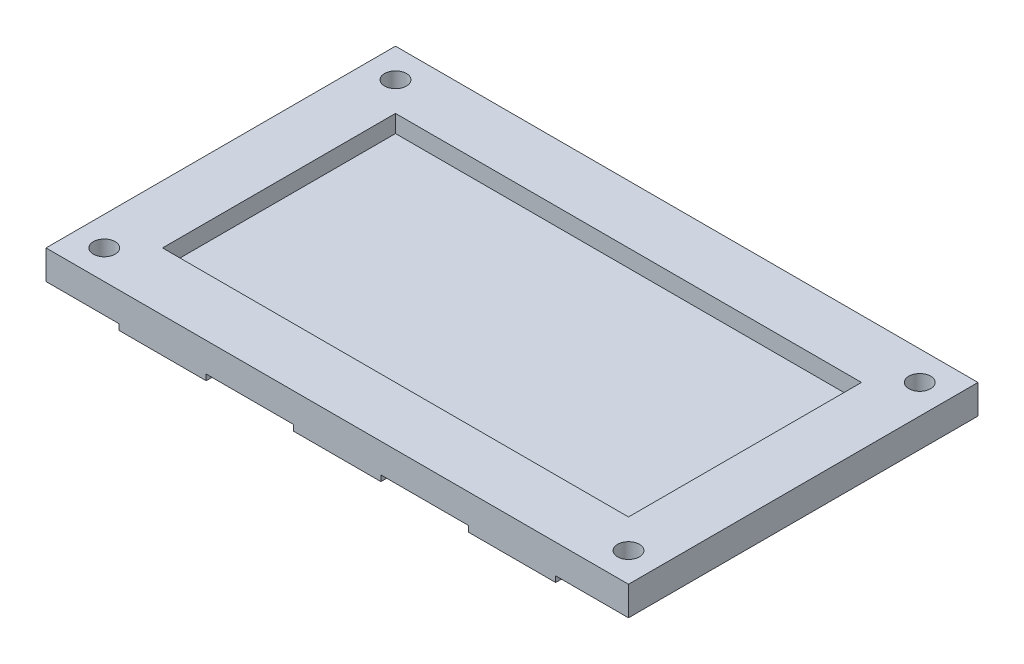
from build123d import *

# Parameters (mm, degrees)
SKETCH1_W             = 200
SKETCH1_H             = 120
BOSS_EXTRUDE3_DEPTH   = 10
SKETCH3_R             = 3.75
SKETCH3_W             = 160
SKETCH3_H             = 80
CUT_EXTRUDE2_DEPTH    = 6
SKETCH6_R             = 3.75
CUT_EXTRUDE4_DEPTH    = 117.773284616
SKETCH7_W             = 30
SKETCH7_H             = 120
BOSS_EXTRUDE4_DEPTH   = 2
SKETCH8_W             = 10
SKETCH8_H             = 5
BOSS_EXTRUDE5_DEPTH   = 2
BOSS_EXTRUDE5_2_DEPTH = 2
BOSS_EXTRUDE5_3_DEPTH = 2
BOSS_EXTRUDE5_4_DEPTH = 2
SKETCH10_W            = 10
SKETCH10_H            = 5
BOSS_EXTRUDE6_DEPTH   = 5


with BuildPart() as part:
    # Sketch1 → Boss-Extrude3 (new body)
    with BuildSketch(Plane(origin=(0, 0, 0), x_dir=(1, 0, 0), z_dir=(0, 1, 0))):
        Rectangle(SKETCH1_W, SKETCH1_H)
    extrude(amount=BOSS_EXTRUDE3_DEPTH)

    # Sketch3 → Cut-Extrude2 (cut)
    with BuildSketch(Plane(origin=(0, 10, 0), x_dir=(1, 0, 0), z_dir=(0, 1, 0))):
        with Locations(Location((-90, 50, 0), (0, 0, 270))):
            Circle(SKETCH3_R)
        with Locations(Location((90, -50, 0), (0, 0, 270))):
            Circle(SKETCH3_R)
        with Locations(Location((90, 50, 0), (0, 0, 270))):
            Circle(SKETCH3_R)
        with Locations(Location((-90, -50, 0), (0, 0, 270))):
            Circle(SKETCH3_R)
        Rectangle(SKETCH3_W, SKETCH3_H)
    extrude(amount=-CUT_EXTRUDE2_DEPTH, mode=Mode.SUBTRACT)

    # Sketch6 → Cut-Extrude4 (cut, through all)
    with BuildSketch(Plane(origin=(0, 4, 0), x_dir=(1, 0, 0), z_dir=(0, 1, 0))):
        with Locations(Location((-90, 50, 0), (0, 0, 270))):
            Circle(SKETCH6_R)
        with Locations(Location((90, 50, 0), (0, 0, 270))):
            Circle(SKETCH6_R)
        with Locations(Location((90, -50, 0), (0, 0, 270))):
            Circle(SKETCH6_R)
        with Locations(Location((-90, -50, 0), (0, 0, 270))):
            Circle(SKETCH6_R)
    extrude(amount=-CUT_EXTRUDE4_DEPTH, mode=Mode.SUBTRACT)

    # Sketch7 → Boss-Extrude4 (add)
    with BuildSketch(Plane(origin=(0, 0, 0), x_dir=(-1, 0, 0), z_dir=(0, -1, 0))):
        Rectangle(SKETCH7_W, SKETCH7_H)
        with Locations((60, 0)):
            Rectangle(SKETCH7_W, SKETCH7_H)
        with Locations((-60, 0)):
            Rectangle(SKETCH7_W, SKETCH7_H)
    extrude(amount=BOSS_EXTRUDE4_DEPTH)



with BuildPart() as body_2:
    # Sketch8 → Boss-Extrude5 (new body)
    with BuildSketch(Plane(origin=(0, -2, 0), x_dir=(-1, 0, 0), z_dir=(0, -1, 0))):
        with Locations((25, -17.5)):
            Rectangle(SKETCH8_W, SKETCH8_H)
    extrude(amount=-BOSS_EXTRUDE5_DEPTH)


with BuildPart() as body_3:
    # Sketch8 → Boss-Extrude5 2 (new body)
    with BuildSketch(Plane(origin=(0, -2, 0), x_dir=(-1, 0, 0), z_dir=(0, -1, 0))):
        with Locations((-25, -17.5)):
            Rectangle(SKETCH8_W, SKETCH8_H)
    extrude(amount=-BOSS_EXTRUDE5_2_DEPTH)


with BuildPart() as body_4:
    # Sketch8 → Boss-Extrude5 3 (new body)
    with BuildSketch(Plane(origin=(0, -2, 0), x_dir=(-1, 0, 0), z_dir=(0, -1, 0))):
        with Locations((-25, 17.5)):
            Rectangle(SKETCH8_W, SKETCH8_H)
    extrude(amount=-BOSS_EXTRUDE5_3_DEPTH)


with BuildPart() as body_5:
    # Sketch8 → Boss-Extrude5 4 (new body)
    with BuildSketch(Plane(origin=(0, -2, 0), x_dir=(-1, 0, 0), z_dir=(0, -1, 0))):
        with Locations((25, 17.5)):
            Rectangle(SKETCH8_W, SKETCH8_H)
    extrude(amount=-BOSS_EXTRUDE5_4_DEPTH)


with BuildPart() as part_1:
    add(part.part)

    add(body_2.part)  # Boss-Extrude6 merges body 2

    add(body_3.part)  # Boss-Extrude6 merges body 3

    add(body_4.part)  # Boss-Extrude6 merges body 4

    add(body_5.part)  # Boss-Extrude6 merges body 5
    # Sketch10 → Boss-Extrude6 (add)
    with BuildSketch(Plane(origin=(0, -2, 0), x_dir=(-1, 0, 0), z_dir=(0, -1, 0))):
        with Locations((25, -17.5)):
            Rectangle(SKETCH10_W, SKETCH10_H)
        with Locations((25, 17.5)):
            Rectangle(SKETCH10_W, SKETCH10_H)
        with Locations((-25, 17.5)):
            Rectangle(SKETCH10_W, SKETCH10_H)
        with Locations((-25, -17.5)):
            Rectangle(SKETCH10_W, SKETCH10_H)
    extrude(amount=BOSS_EXTRUDE6_DEPTH)


solid = part_1.part
